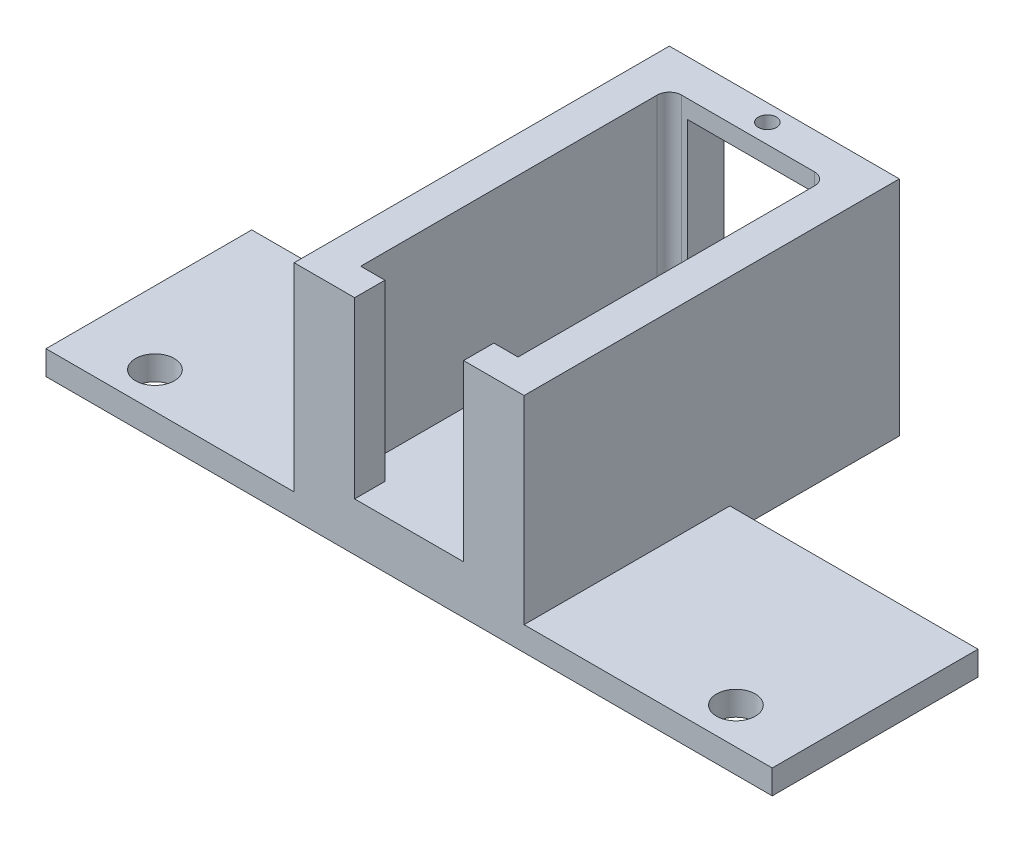
from build123d import *

# Parameters (mm, degrees)
SKETCH1_W           = 60
SKETCH1_H           = 17
BOSS_EXTRUDE1_DEPTH = 4
SKETCH4_W           = 19
SKETCH4_H           = 4
BOSS_EXTRUDE2_DEPTH = 14
SKETCH5_W           = 3
SKETCH5_H           = 31
BOSS_EXTRUDE3_DEPTH = 14.4
SKETCH6_W           = 13
SKETCH6_H           = 2.5
BOSS_EXTRUDE4_DEPTH = 14.4
SKETCH7_W           = 9
SKETCH7_H           = 2.5
CUT_EXTRUDE1_DEPTH  = 14.4
SKETCH8_W           = 13
SKETCH8_H           = 3
BOSS_EXTRUDE5_DEPTH = 14.4
SKETCH9_R           = 0.75
CUT_EXTRUDE2_DEPTH  = 6
SKETCH10_W          = 10
SKETCH10_H          = 8
CUT_EXTRUDE3_DEPTH  = 3
FILLET1_R           = 1
SKETCH11_R          = 1.6
CUT_EXTRUDE4_DEPTH  = 4
SKETCH12_W          = 20.5
SKETCH12_H          = 17
CUT_EXTRUDE5_DEPTH  = 2
SKETCH13_W          = 10
SKETCH13_H          = 3
CUT_EXTRUDE6_DEPTH  = 5


with BuildPart() as part:
    # Sketch1 → Boss-Extrude1 (new body)
    with BuildSketch(Plane(origin=(0, 0, 0), x_dir=(1, 0, 0), z_dir=(0, 1, 0))):
        Rectangle(SKETCH1_W, SKETCH1_H)
    extrude(amount=BOSS_EXTRUDE1_DEPTH)

    # Sketch4 → Boss-Extrude2 (add)
    with BuildSketch(Plane(origin=(0, 0, -8.5), x_dir=(-1, 0, 0), z_dir=(0, 0, -1))):
        with Locations((0, 2)):
            Rectangle(SKETCH4_W, SKETCH4_H)
    extrude(amount=BOSS_EXTRUDE2_DEPTH)

    # Sketch5 → Boss-Extrude3 (add)
    with BuildSketch(Plane(origin=(0, 4, 0), x_dir=(1, 0, 0), z_dir=(0, 1, 0))):
        with Locations((-8, 7)):
            Rectangle(SKETCH5_W, SKETCH5_H)
    boss_extrude3 = extrude(amount=BOSS_EXTRUDE3_DEPTH)

    # Mirror1: Boss-Extrude3 across plane
    add(boss_extrude3.mirror(Plane(origin=(0, 0, 0), x_dir=(0, 0, 1), z_dir=(1, 0, 0))))

    # Sketch6 → Boss-Extrude4 (add)
    with BuildSketch(Plane(origin=(0, 4, 0), x_dir=(1, 0, 0), z_dir=(0, 1, 0))):
        with Locations((0, -7.25)):
            Rectangle(SKETCH6_W, SKETCH6_H)
    extrude(amount=BOSS_EXTRUDE4_DEPTH)

    # Sketch7 → Cut-Extrude1 (cut)
    with BuildSketch(Plane(origin=(0, 18.4, 0), x_dir=(1, 0, 0), z_dir=(0, 1, 0))):
        with Locations((0, -7.25)):
            Rectangle(SKETCH7_W, SKETCH7_H)
    extrude(amount=-CUT_EXTRUDE1_DEPTH, mode=Mode.SUBTRACT)

    # Sketch8 → Boss-Extrude5 (add)
    with BuildSketch(Plane(origin=(0, 4, 0), x_dir=(1, 0, 0), z_dir=(0, 1, 0))):
        with Locations((0, 21)):
            Rectangle(SKETCH8_W, SKETCH8_H)
    extrude(amount=BOSS_EXTRUDE5_DEPTH)

    # Sketch9 → Cut-Extrude2 (cut)
    with BuildSketch(Plane(origin=(0, 18.4, 0), x_dir=(1, 0, 0), z_dir=(0, 1, 0))):
        with Locations(Location((0, 21.1, 0), (0, 0, 270))):
            Circle(SKETCH9_R)
    extrude(amount=-CUT_EXTRUDE2_DEPTH, mode=Mode.SUBTRACT)

    # Sketch10 → Cut-Extrude3 (cut)
    with BuildSketch(Plane(origin=(0, 0, -22.5), x_dir=(-1, 0, 0), z_dir=(0, 0, -1))):
        with Locations((0, 12.9)):
            Rectangle(SKETCH10_W, SKETCH10_H)
    extrude(amount=-CUT_EXTRUDE3_DEPTH, mode=Mode.SUBTRACT)

    # Fillet1
    fillet1_edges = [part.edges().sort_by_distance(p)[0] for p in [
        (-6.5, 11.2, -19.5),
        (6.5, 11.2, -19.5),
    ]]
    fillet(fillet1_edges, radius=FILLET1_R)

    # Sketch11 → Cut-Extrude4 (cut)
    with BuildSketch(Plane(origin=(0, 4, 0), x_dir=(1, 0, 0), z_dir=(0, 1, 0))):
        with Locations(Location((-24, -5.5, 0), (0, 0, 270))):
            Circle(SKETCH11_R)
        with Locations(Location((24, -5.5, 0), (0, 0, 270))):
            Circle(SKETCH11_R)
    extrude(amount=-CUT_EXTRUDE4_DEPTH, mode=Mode.SUBTRACT)

    # Sketch12 → Cut-Extrude5 (cut)
    with BuildSketch(Plane(origin=(0, 4, 0), x_dir=(1, 0, 0), z_dir=(0, 1, 0))):
        with Locations((-19.75, 0)):
            Rectangle(SKETCH12_W, SKETCH12_H)
    cut_extrude5 = extrude(amount=-CUT_EXTRUDE5_DEPTH, mode=Mode.SUBTRACT)

    # Mirror2: Cut-Extrude5 across plane
    add(cut_extrude5.mirror(Plane(origin=(0, 0, 0), x_dir=(0, 0, 1), z_dir=(1, 0, 0))), mode=Mode.SUBTRACT)

    # Sketch13 → Cut-Extrude6 (cut)
    with BuildSketch(Plane(origin=(0, 8.9, 0), x_dir=(1, 0, 0), z_dir=(0, 1, 0))):
        with Locations((0, 21)):
            Rectangle(SKETCH13_W, SKETCH13_H)
    extrude(amount=-CUT_EXTRUDE6_DEPTH, mode=Mode.SUBTRACT)


solid = part.part
